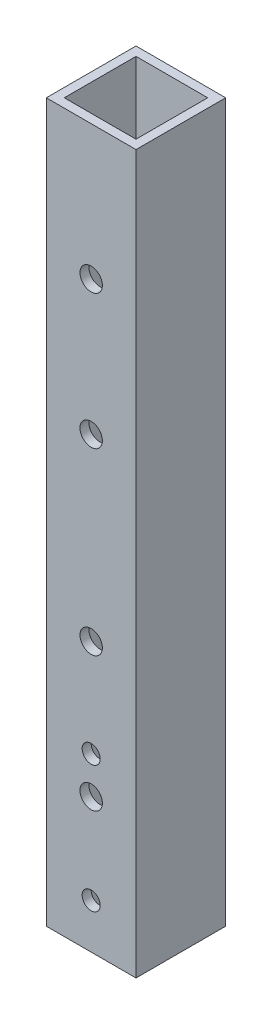
from build123d import *

# Parameters (mm, degrees)
SKETCH1_W              = 25.4
SKETCH1_H              = 25.4
SKETCH1_W_2            = 20.32
SKETCH1_H_2            = 20.32
BOSS_EXTRUDE1_DEPTH    = 101.6
SKETCH4_R              = 3.175
CUT_EXTRUDE3_DEPTH     = 25.4
SKETCH5_R              = 3.175
CUT_EXTRUDE4_DEPTH     = 25.4
SKETCH6_R              = 1.27
CUT_EXTRUDE6_DEPTH     = 25.4
F_10_CLEARANCE_HOLE1_D = 5.1054


with BuildPart() as part:
    # Sketch1 → Boss-Extrude1 (new, symmetric)
    with BuildSketch(Plane(origin=(0, 0, 0), x_dir=(1, 0, 0), z_dir=(0, 1, 0))):
        Rectangle(SKETCH1_W, SKETCH1_H)
        Rectangle(SKETCH1_W_2, SKETCH1_H_2, mode=Mode.SUBTRACT)
    extrude(amount=BOSS_EXTRUDE1_DEPTH, both=True)

    # Sketch4 → Cut-Extrude3 (cut)
    with BuildSketch(Plane.XY.offset(12.7)):
        with Locations((0, 63.5)):
            Circle(SKETCH4_R)
        with Locations((0, -63.5)):
            Circle(SKETCH4_R)
    extrude(amount=-CUT_EXTRUDE3_DEPTH, mode=Mode.SUBTRACT)

    # Sketch5 → Cut-Extrude4 (cut)
    with BuildSketch(Plane.XY.offset(12.7)):
        with Locations((0, 25.4)):
            Circle(SKETCH5_R)
        with Locations((0, -25.4)):
            Circle(SKETCH5_R)
    extrude(amount=-CUT_EXTRUDE4_DEPTH, mode=Mode.SUBTRACT)

    # Sketch6 → Cut-Extrude6 (cut)
    with BuildSketch(Plane.XY.offset(12.7)):
        with Locations((0, -88.9)):
            Circle(SKETCH6_R)
        with Locations((0, -52.959)):
            Circle(SKETCH6_R)
    extrude(amount=-CUT_EXTRUDE6_DEPTH, mode=Mode.SUBTRACT)

    # #10 Clearance Hole1 (through all)
    with Locations(Plane(origin=(0, 0, -12.7), x_dir=(-1, 0, 0), z_dir=(0, 0, -1))):
        with Locations((0, -52.959), (0, -88.9)):
            Hole(F_10_CLEARANCE_HOLE1_D / 2)


solid = part.part
